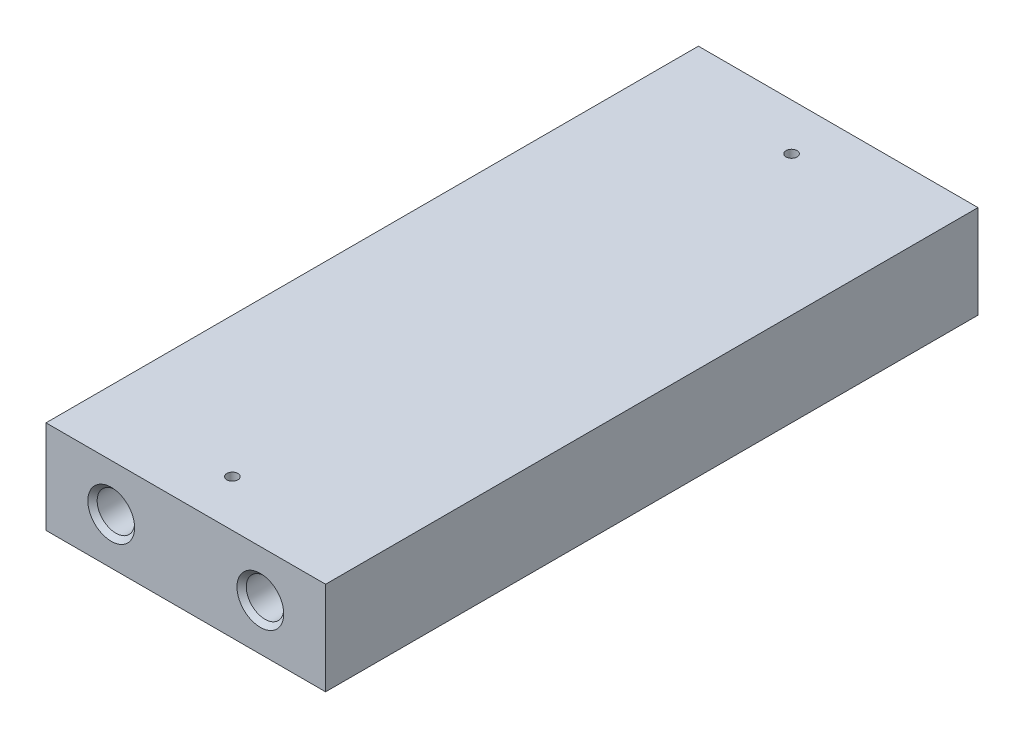
from build123d import *

# Parameters (mm, degrees)
SKETCH1_W                         = 38.1
SKETCH1_H                         = 12.7
BOSS_EXTRUDE1_DEPTH               = 88.9
F_1_4_20_TAPPED_HOLE1_AT_2_COUNT  = 2
F_1_4_20_TAPPED_HOLE1_AT_2_PITCH  = 20.32
F_1_64_TAPPED_HOLE1_D             = 1.5113
F_1_4_20_TAPPED_HOLE3_D           = 5.1054
F_1_4_20_TAPPED_HOLE3_DEPTH       = 13.97
F_1_4_20_TAPPED_HOLE3_CSINK_D     = 6.3754
F_1_4_20_TAPPED_HOLE3_CSINK_ANGLE = 90
F_1_4_20_TAPPED_HOLE3_TIP         = 1.533816902


with BuildPart() as part:
    # Sketch1 → Boss-Extrude1 (new body)
    with BuildSketch(Plane.XY):
        Rectangle(SKETCH1_W, SKETCH1_H)
    extrude(amount=-BOSS_EXTRUDE1_DEPTH)

    # Sketch4 → 1/4-20 Tapped Hole1 (revolve, cut)
    with BuildSketch(Plane(origin=(-10.16, 0, 0), x_dir=(0, -1, 0), z_dir=(1, 0, 0))):
        Polygon((0, 0), (0, 14.233816902), (2.5527, 12.7), (2.5527, 0.635), (3.1877, 0), align=None)
    f_1_4_20_tapped_hole1 = revolve(axis=Axis((-10.16, 0, 6.35), (0, 0, -1)), mode=Mode.SUBTRACT)

    # 1/4-20 Tapped Hole1 at 2: 1/4-20 Tapped Hole1 ×2
    with Locations(*[(i * F_1_4_20_TAPPED_HOLE1_AT_2_PITCH, 0, 0) for i in range(1, F_1_4_20_TAPPED_HOLE1_AT_2_COUNT)]):
        add(f_1_4_20_tapped_hole1, mode=Mode.SUBTRACT)

    # Mirror1: 1/4-20 Tapped Hole1 across plane
    add(f_1_4_20_tapped_hole1.mirror(Plane.XY.offset(-44.45)), mode=Mode.SUBTRACT)

    # Mirror1 copy 1 sketch → Mirror1 copy 1 (revolve, cut)
    with BuildSketch(Plane(origin=(10.16, 0, -88.9), x_dir=(0, -1, 0), z_dir=(1, 0, 0))):
        Polygon((0, 0), (0, -14.233816902), (2.5527, -12.7), (2.5527, -0.635), (3.1877, 0), align=None)
    revolve(axis=Axis((10.16, 0, -95.25), (0, 0, -1)), mode=Mode.SUBTRACT)

    # #1-64 Tapped Hole1 (through all)
    with Locations(Plane(origin=(0, 6.35, -82.55), x_dir=(0, 0, 1), z_dir=(0, 1, 0))):
        with Locations((0, 0), (76.2, 0)):
            Hole(F_1_64_TAPPED_HOLE1_D / 2)

    # 1/4-20 Tapped Hole3
    with Locations(Plane.ZY.offset(19.05)):
        with Locations((-69.85, 0), (-19.05, 0)):
            CounterSinkHole(F_1_4_20_TAPPED_HOLE3_D / 2, F_1_4_20_TAPPED_HOLE3_CSINK_D / 2, depth=F_1_4_20_TAPPED_HOLE3_DEPTH, counter_sink_angle=F_1_4_20_TAPPED_HOLE3_CSINK_ANGLE)
            with Locations((0, 0, -(F_1_4_20_TAPPED_HOLE3_DEPTH + F_1_4_20_TAPPED_HOLE3_TIP / 2))):  # 118° drill point
                Cone(0, F_1_4_20_TAPPED_HOLE3_D / 2, F_1_4_20_TAPPED_HOLE3_TIP, mode=Mode.SUBTRACT)


solid = part.part
